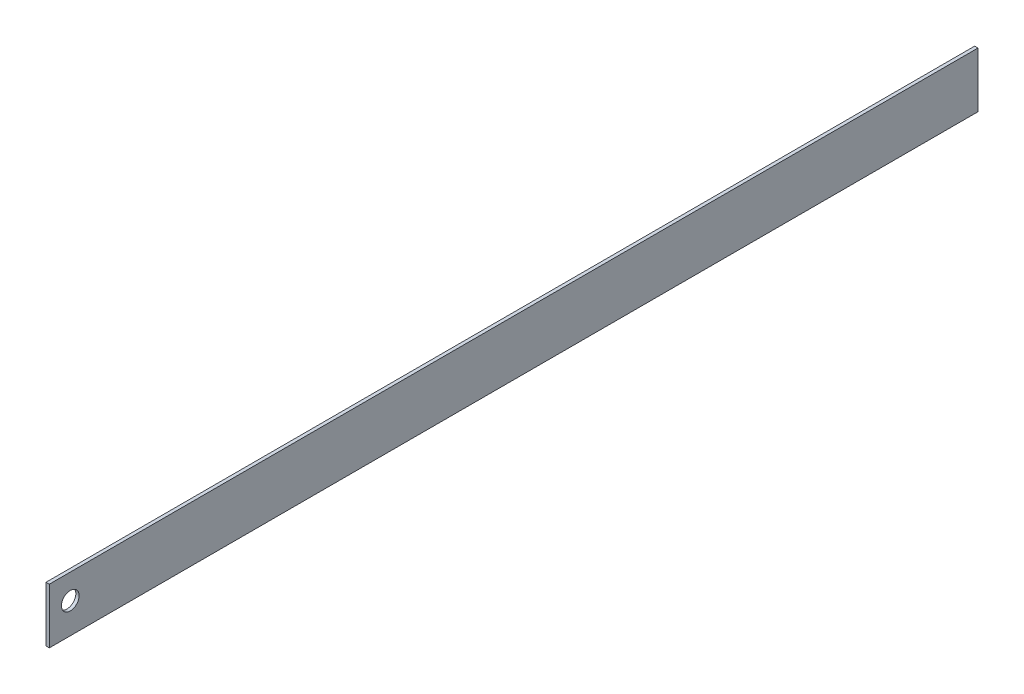
from build123d import *

# Parameters (mm, degrees)
SKETCH2_W           = 84.1
SKETCH2_H           = 5
SKETCH2_R           = 0.8
BOSS_EXTRUDE1_DEPTH = 0.3


with BuildPart() as part:
    # Sketch2 → Boss-Extrude1 (new body)
    with BuildSketch(Plane(origin=(0, 0, 0), x_dir=(0, 0, -1), z_dir=(1, 0, 0))):
        with Locations((42.05, 2.5)):
            Rectangle(SKETCH2_W, SKETCH2_H)
        with Locations((1.8995, 2.755)):
            Circle(SKETCH2_R, mode=Mode.SUBTRACT)
    extrude(amount=BOSS_EXTRUDE1_DEPTH)


solid = part.part
